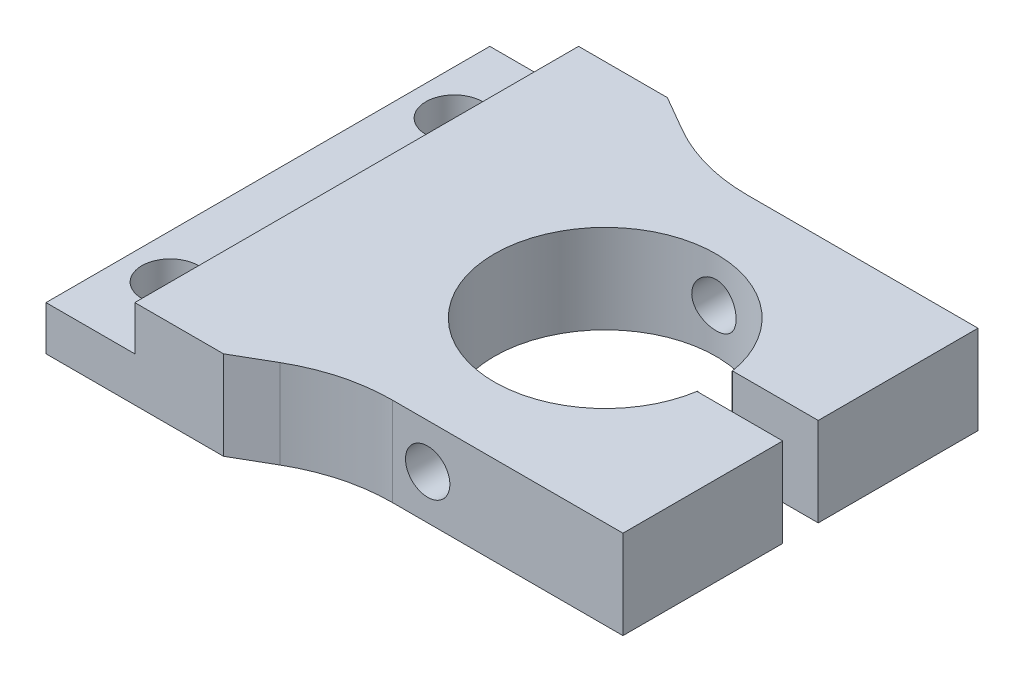
from build123d import *

# Parameters (mm, degrees)
SKIZZE1_W                              = 30
SKIZZE1_H                              = 25
AUFSATZ_LINEAR_AUSTRAGEN1_DEPTH        = 5
SKIZZE2_W                              = 5
SKIZZE2_H                              = 25
SCHNITT_LINEAR_AUSTRAGEN1_DEPTH        = 2.5
F_12_5_12_5_DURCHMESSER_BOHRUNG1_D     = 12.5
F_12_5_12_5_DURCHMESSER_BOHRUNG1_DEPTH = 5
F_12_5_12_5_DURCHMESSER_BOHRUNG1_TIP   = 3.755378869
DURCHGANGSLOCH_F_R_M31_D               = 3.2
DURCHGANGSLOCH_F_R_M31_DEPTH           = 5
DURCHGANGSLOCH_F_R_M31_TIP             = 0.96137699
SCHNITT_LINEAR_AUSTRAGEN2_DEPTH        = 33.882366095
SKIZZE8_W                              = 4.823257392
SKIZZE8_H                              = 2
SCHNITT_LINEAR_AUSTRAGEN3_DEPTH        = 10
VERRUNDUNG1_R                          = 10
M3_GEWINDEBOHRUNG2_D                   = 2.5


with BuildPart() as part:
    # Skizze1 → Aufsatz-Linear austragen1 (new body)
    with BuildSketch(Plane(origin=(0, 0, 0), x_dir=(1, 0, 0), z_dir=(0, 1, 0))):
        with Locations((15, 0)):
            Rectangle(SKIZZE1_W, SKIZZE1_H)
    extrude(amount=AUFSATZ_LINEAR_AUSTRAGEN1_DEPTH)

    # Skizze2 → Schnitt-Linear austragen1 (cut)
    with BuildSketch(Plane(origin=(0, 5, 0), x_dir=(1, 0, 0), z_dir=(0, 1, 0))):
        with Locations((2.5, 0)):
            Rectangle(SKIZZE2_W, SKIZZE2_H)
    extrude(amount=-SCHNITT_LINEAR_AUSTRAGEN1_DEPTH, mode=Mode.SUBTRACT)

    # Ø12.5 (12.5) Durchmesser Bohrung1
    with Locations(Plane(origin=(0, 5, 0), x_dir=(1, 0, 0), z_dir=(0, 1, 0))):
        with Locations((19, 0)):
            Hole(F_12_5_12_5_DURCHMESSER_BOHRUNG1_D / 2, depth=F_12_5_12_5_DURCHMESSER_BOHRUNG1_DEPTH)
            with Locations((0, 0, -(F_12_5_12_5_DURCHMESSER_BOHRUNG1_DEPTH + F_12_5_12_5_DURCHMESSER_BOHRUNG1_TIP / 2))):  # 118° drill point
                Cone(0, F_12_5_12_5_DURCHMESSER_BOHRUNG1_D / 2, F_12_5_12_5_DURCHMESSER_BOHRUNG1_TIP, mode=Mode.SUBTRACT)

    # Durchgangsloch für M31
    with Locations(Plane(origin=(0, 0, 0), x_dir=(-1, 0, 0), z_dir=(0, -1, 0))):
        with Locations((-2.5, 8), (-2.5, -8)):
            Hole(DURCHGANGSLOCH_F_R_M31_D / 2, depth=DURCHGANGSLOCH_F_R_M31_DEPTH)
            with Locations((0, 0, -(DURCHGANGSLOCH_F_R_M31_DEPTH + DURCHGANGSLOCH_F_R_M31_TIP / 2))):  # 118° drill point
                Cone(0, DURCHGANGSLOCH_F_R_M31_D / 2, DURCHGANGSLOCH_F_R_M31_TIP, mode=Mode.SUBTRACT)

    # Skizze7 → Schnitt-Linear austragen2 (cut, through all)
    with BuildSketch(Plane(origin=(0, 5, 0), x_dir=(1, 0, 0), z_dir=(0, 1, 0))):
        Polygon((10, 12.5), (14.330127019, 10), (30, 10), (30, 12.5), align=None)
        Polygon((30, -10), (14.330127019, -10), (10, -12.5), (30, -12.5), align=None)
    extrude(amount=-SCHNITT_LINEAR_AUSTRAGEN2_DEPTH, mode=Mode.SUBTRACT)

    # Skizze8 → Schnitt-Linear austragen3 (cut)
    with BuildSketch(Plane(origin=(0, 5, 0), x_dir=(1, 0, 0), z_dir=(0, 1, 0))):
        with Locations((27.588371304, 0)):
            Rectangle(SKIZZE8_W, SKIZZE8_H)
    extrude(amount=-SCHNITT_LINEAR_AUSTRAGEN3_DEPTH, mode=Mode.SUBTRACT)

    # Verrundung1
    verrundung1_edges = [part.edges().sort_by_distance(p)[0] for p in [
        (14.330127019, 2.5, -10),
        (14.330127019, 2.5, 10),
    ]]
    fillet(verrundung1_edges, radius=VERRUNDUNG1_R)

    # M3 Gewindebohrung2 (through all)
    with Locations(Plane.XY.offset(10)):
        with Locations((19, 2.5)):
            Hole(M3_GEWINDEBOHRUNG2_D / 2)


solid = part.part
